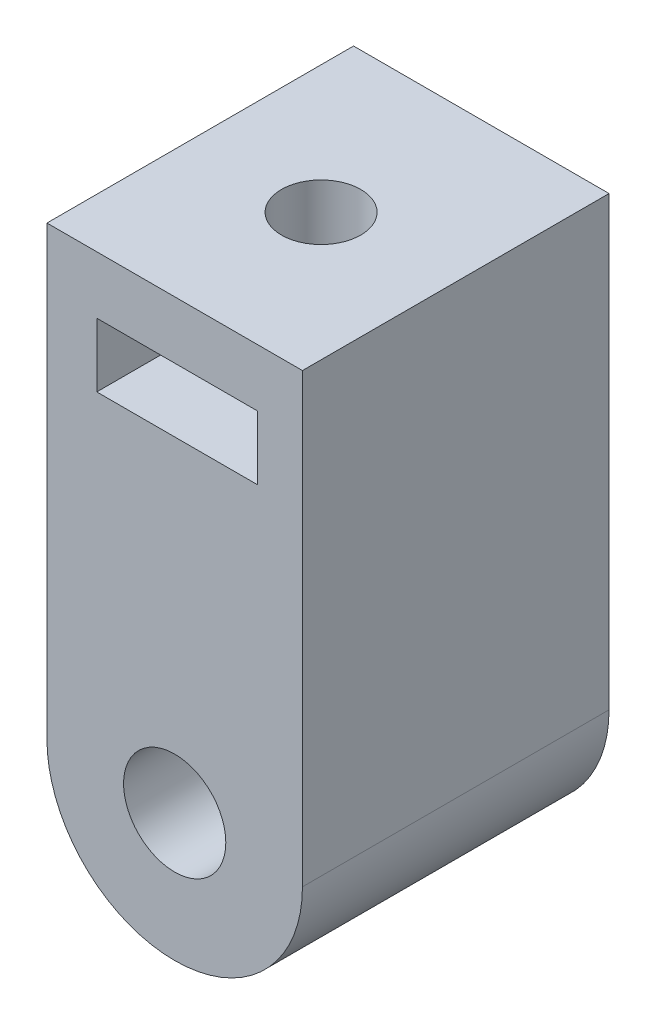
from build123d import *

# Parameters (mm, degrees)
SKETCH_1_R          = 5
SKETCH_1_R_2        = 2
EXTRUDE_1_DEPTH     = 12
SKETCH_2_W          = 10
SKETCH_2_H          = 17.5
EXTRUDE_2_DEPTH     = 12
SKETCH_3_R          = 2
CUT_EXTRUDE_1_DEPTH = 22.800229357
SKETCH_5_W          = 6.3
SKETCH_5_H          = 2.5
CUT_EXTRUDE_3_DEPTH = 8.48
SKETCH_10_W         = 9.65653404
SKETCH_10_H         = 7.55
CUT_EXTRUDE_5_DEPTH = 9.4
CUT_EXTRUDE_4_REACH = 27.986
SKETCH_6_R          = 1.55


with BuildPart() as part:
    # Эскиз1 → Бобышка-Вытянуть1 (new body)
    with BuildSketch(Plane.XY):
        Circle(SKETCH_1_R)
        Circle(SKETCH_1_R_2, mode=Mode.SUBTRACT)
    extrude(amount=EXTRUDE_1_DEPTH)

    # Эскиз2 → Бобышка-Вытянуть2 (add)
    with BuildSketch(Plane.XY.offset(12)):
        with Locations((0, 8.75)):
            Rectangle(SKETCH_2_W, SKETCH_2_H)
    extrude(amount=-EXTRUDE_2_DEPTH)

    # Эскиз3 → Вырез-Вытянуть1 (cut, through all)
    with BuildSketch(Plane.XY.offset(12)):
        Circle(SKETCH_3_R)
    extrude(amount=-CUT_EXTRUDE_1_DEPTH, mode=Mode.SUBTRACT)

    # Эскиз5 → Вырез-Вытянуть3 (cut)
    with BuildSketch(Plane.XY.offset(12)):
        with Locations((0.1, 14)):
            Rectangle(SKETCH_5_W, SKETCH_5_H)
    extrude(amount=-CUT_EXTRUDE_3_DEPTH, mode=Mode.SUBTRACT)

    # Эскиз10 → Вырез-Вытянуть5 (cut)
    with BuildSketch(Plane.ZY.offset(5)):
        with Locations((6.27, 6.7)):
            Rectangle(SKETCH_10_W, SKETCH_10_H)
    extrude(amount=-CUT_EXTRUDE_5_DEPTH, mode=Mode.SUBTRACT)

    # Вырез-Вытянуть4: up to this face of the body (flat: up to its plane)
    cut_extrude_4_end = Plane(part.part.faces().sort_by_distance((-0.3, 10.475, 6.27))[0])
    # Эскиз6 → Вырез-Вытянуть4 (cut, up to the picked face)
    with BuildSketch(Plane(origin=(0, 17.5, 0), x_dir=(1, 0, 0), z_dir=(0, 1, 0)), mode=Mode.PRIVATE) as cut_extrude_4_sk1:
        with Locations(Location((0, -6.27, 0), (0, 0, 270))):
            Circle(SKETCH_6_R)
    cut_extrude_4_tool1 = split(extrude(cut_extrude_4_sk1.sketch, amount=-CUT_EXTRUDE_4_REACH, mode=Mode.PRIVATE), bisect_by=cut_extrude_4_end, keep=Keep.BOTH, mode=Mode.PRIVATE)
    add(cut_extrude_4_tool1.solids().sort_by(Axis((0, 17.5, 6.27), (0, -1, 0)))[0], mode=Mode.SUBTRACT)


solid = part.part
